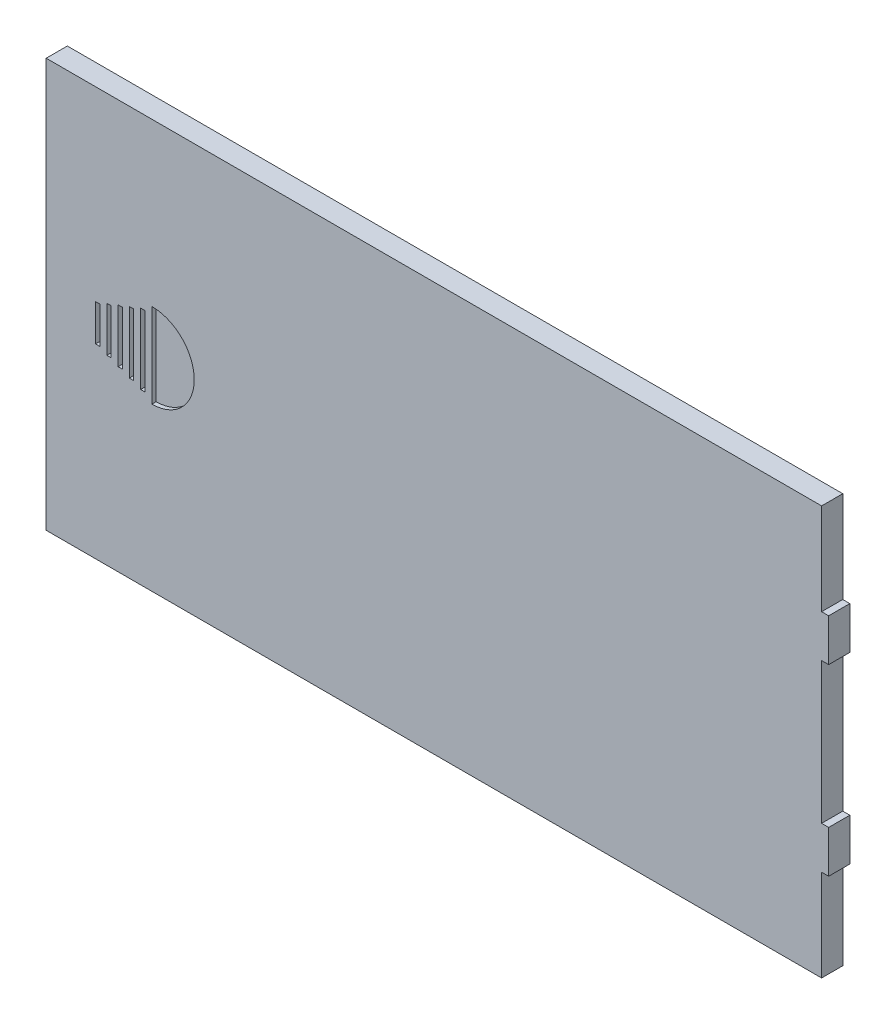
from build123d import *

# Parameters (mm, degrees)
EXTRUDE_1_DEPTH     = 1.5
SKETCH_2_W          = 0.3
SKETCH_2_H          = 5
SKETCH_2_H_2        = 4.4
SKETCH_2_H_3        = 3.8
SKETCH_2_H_4        = 3.2
SKETCH_2_H_5        = 2.6
CUT_EXTRUDE_1_DEPTH = 0.3


with BuildPart() as part:
    # 草图1 → 凸台-拉伸1 (new body)
    with BuildSketch(Plane.XY):
        Polygon((27.5, 8), (28, 8), (28, 5), (27.5, 5), (27.5, -5), (28, -5), (28, -8), (27.5, -8), (27.5, -14.5), (-27.5, -14.5), (-27.5, 14.5), (27.5, 14.5), align=None)
    extrude(amount=EXTRUDE_1_DEPTH)

    # 草图2 → 切除-拉伸1 (cut)
    with BuildSketch(Plane.XY.offset(1.5)):
        with BuildLine():
            Line((-20, 3), (-20, -3))
            ThreePointArc((-20, -3), (-17, 0), (-20, 3))
        make_face()
        with Locations((-20.65, 0)):
            Rectangle(SKETCH_2_W, SKETCH_2_H)
        with Locations((-21.45, 0)):
            Rectangle(SKETCH_2_W, SKETCH_2_H_2)
        with Locations((-22.25, 0)):
            Rectangle(SKETCH_2_W, SKETCH_2_H_3)
        with Locations((-23.05, 0)):
            Rectangle(SKETCH_2_W, SKETCH_2_H_4)
        with Locations((-23.85, 0)):
            Rectangle(SKETCH_2_W, SKETCH_2_H_5)
    extrude(amount=-CUT_EXTRUDE_1_DEPTH, mode=Mode.SUBTRACT)


solid = part.part
